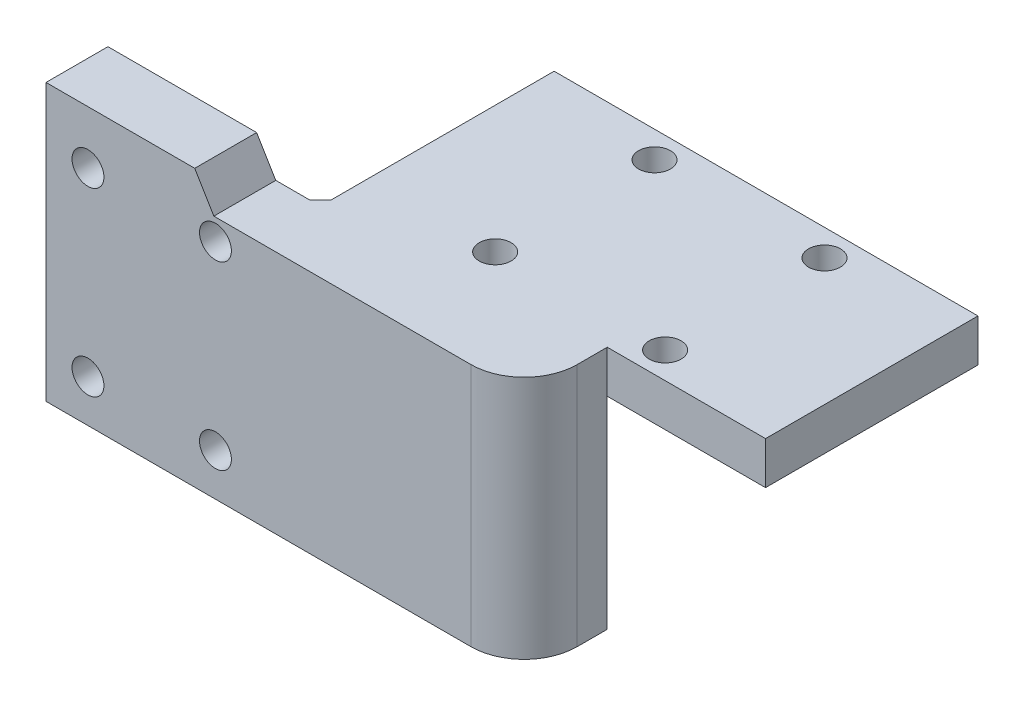
from build123d import *

# Parameters (mm, degrees)
SKETCH_1_W          = 39.9
SKETCH_1_H          = 20
SKETCH_1_R          = 1.5
EXTRUDE_1_DEPTH     = 4
EXTRUDE_4_DEPTH     = 20
SKETCH_7_R          = 1.5
CUT_EXTRUDE_3_DEPTH = 15
SKETCH_8_W          = 25
SKETCH_8_H          = 23
EXTRUDE_5_DEPTH     = 7.83
SKETCH_9_W          = 20
SKETCH_9_H          = 4
CUT_EXTRUDE_4_DEPTH = 20
FILLET_1_R          = 5
SKETCH_12_W         = 20
SKETCH_12_H         = 23
CUT_EXTRUDE_5_DEPTH = 2
SKETCH_14_W         = 20
SKETCH_14_H         = 5.83
EXTRUDE_6_DEPTH     = 3
CHAMFER_1_SIZE      = 1
CUT_EXTRUDE_6_DEPTH = 10


with BuildPart() as part:
    # 草图1 → 凸台-拉伸1 (new body)
    with BuildSketch(Plane(origin=(0, 0, 0), x_dir=(1, 0, 0), z_dir=(0, 1, 0))):
        Rectangle(SKETCH_1_W, SKETCH_1_H)
        with Locations(Location((8, 7.5, 0), (0, 0, 270))):
            Circle(SKETCH_1_R, mode=Mode.SUBTRACT)
        with Locations(Location((8, -7.5, 0), (0, 0, 90))):
            Circle(SKETCH_1_R, mode=Mode.SUBTRACT)
        with Locations(Location((-8, -7.5, 0), (0, 0, 270))):
            Circle(SKETCH_1_R, mode=Mode.SUBTRACT)
        with Locations(Location((-8, 7.5, 0), (0, 0, 90))):
            Circle(SKETCH_1_R, mode=Mode.SUBTRACT)
    extrude(amount=EXTRUDE_1_DEPTH)

    # 草图6 → 凸台-拉伸4 (add)
    with BuildSketch(Plane.ZY.offset(19.95)):
        Polygon((-10, 4), (10, 4), (17.83, 4), (17.83, -19), (10, -19), (10, 0), (-10, 0), align=None)
    extrude(amount=EXTRUDE_4_DEPTH)

    # 草图7 → 切除-拉伸3 (cut)
    with BuildSketch(Plane.XY.offset(17.83)):
        with Locations((-36, 2)):
            Circle(SKETCH_7_R)
        with Locations((-24, 2)):
            Circle(SKETCH_7_R)
        with Locations((-36, -15)):
            Circle(SKETCH_7_R)
        with Locations((-24, -15)):
            Circle(SKETCH_7_R)
    extrude(amount=-CUT_EXTRUDE_3_DEPTH, mode=Mode.SUBTRACT)

    # 草图8 → 凸台-拉伸5 (add)
    with BuildSketch(Plane.XY.offset(10)):
        with Locations((-7.45, -7.5)):
            Rectangle(SKETCH_8_W, SKETCH_8_H)
    extrude(amount=EXTRUDE_5_DEPTH)

    # 草图9 → 切除-拉伸4 (cut)
    with BuildSketch(Plane(origin=(0, 0, -10), x_dir=(-1, 0, 0), z_dir=(0, 0, -1))):
        with Locations((29.95, 2)):
            Rectangle(SKETCH_9_W, SKETCH_9_H)
    extrude(amount=-CUT_EXTRUDE_4_DEPTH, mode=Mode.SUBTRACT)

    # 圆角1
    fillet_1_edges = [part.edges().sort_by_distance(p)[0] for p in [
        (5.05, -7.5, 17.83),
    ]]
    fillet(fillet_1_edges, radius=FILLET_1_R)

    # 草图12 → 切除-拉伸5 (cut)
    with BuildSketch(Plane(origin=(0, 0, 10), x_dir=(-1, 0, 0), z_dir=(0, 0, -1))):
        with Locations((29.95, -7.5)):
            Rectangle(SKETCH_12_W, SKETCH_12_H)
    extrude(amount=-CUT_EXTRUDE_5_DEPTH, mode=Mode.SUBTRACT)

    # 草图14 → 凸台-拉伸6 (add)
    with BuildSketch(Plane(origin=(0, 4, 0), x_dir=(1, 0, 0), z_dir=(0, 1, 0))):
        with Locations((-29.95, -14.915)):
            Rectangle(SKETCH_14_W, SKETCH_14_H)
    extrude(amount=EXTRUDE_6_DEPTH)

    # 倒角1
    chamfer_1_edges = [part.edges().sort_by_distance(p)[0] for p in [
        (-19.95, -7.5, 12),
    ]]
    chamfer(chamfer_1_edges, length=CHAMFER_1_SIZE)

    # 草图16 → 切除-拉伸6 (cut)
    with BuildSketch(Plane.XY.offset(17.83)):
        Polygon((-19.95, 4), (-24.15, 4), (-25.95, 7), (-19.95, 7), align=None)
    extrude(amount=-CUT_EXTRUDE_6_DEPTH, mode=Mode.SUBTRACT)


solid = part.part
